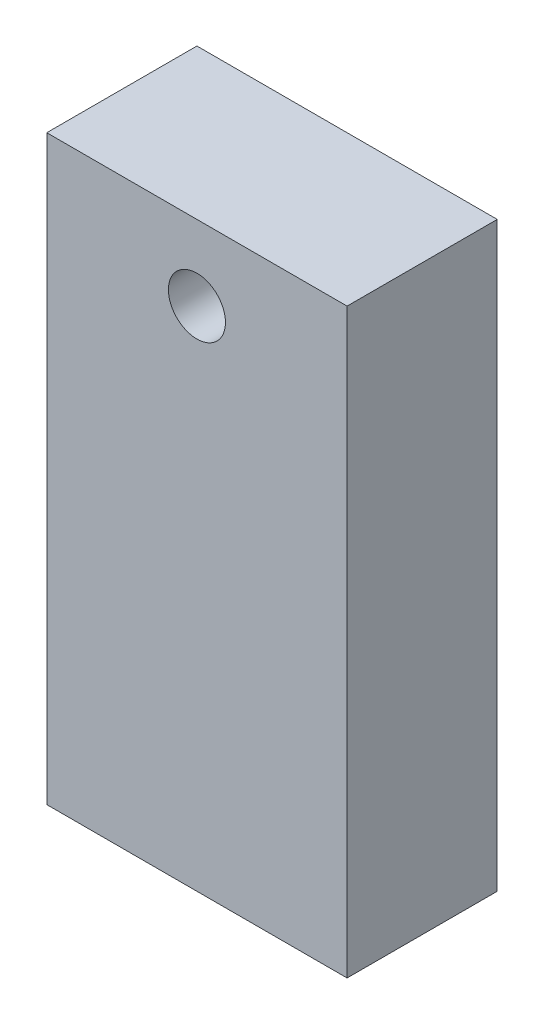
from build123d import *

# Parameters (mm, degrees)
SKETCH2_W           = 50.8
SKETCH2_H           = 25.4
BOSS_EXTRUDE1_DEPTH = 98.425
SKETCH3_R           = 4.826
CUT_EXTRUDE1_DEPTH  = 114.636616568


with BuildPart() as part:
    # Sketch2 → Boss-Extrude1 (new body)
    with BuildSketch(Plane(origin=(0, 0, 0), x_dir=(1, 0, 0), z_dir=(0, 1, 0))):
        with Locations((25.4, 12.7)):
            Rectangle(SKETCH2_W, SKETCH2_H)
    extrude(amount=BOSS_EXTRUDE1_DEPTH)

    # Sketch3 → Cut-Extrude1 (cut, through all)
    with BuildSketch(Plane.XY):
        with Locations((25.4, 85.725)):
            Circle(SKETCH3_R)
    extrude(amount=-CUT_EXTRUDE1_DEPTH, mode=Mode.SUBTRACT)


solid = part.part
